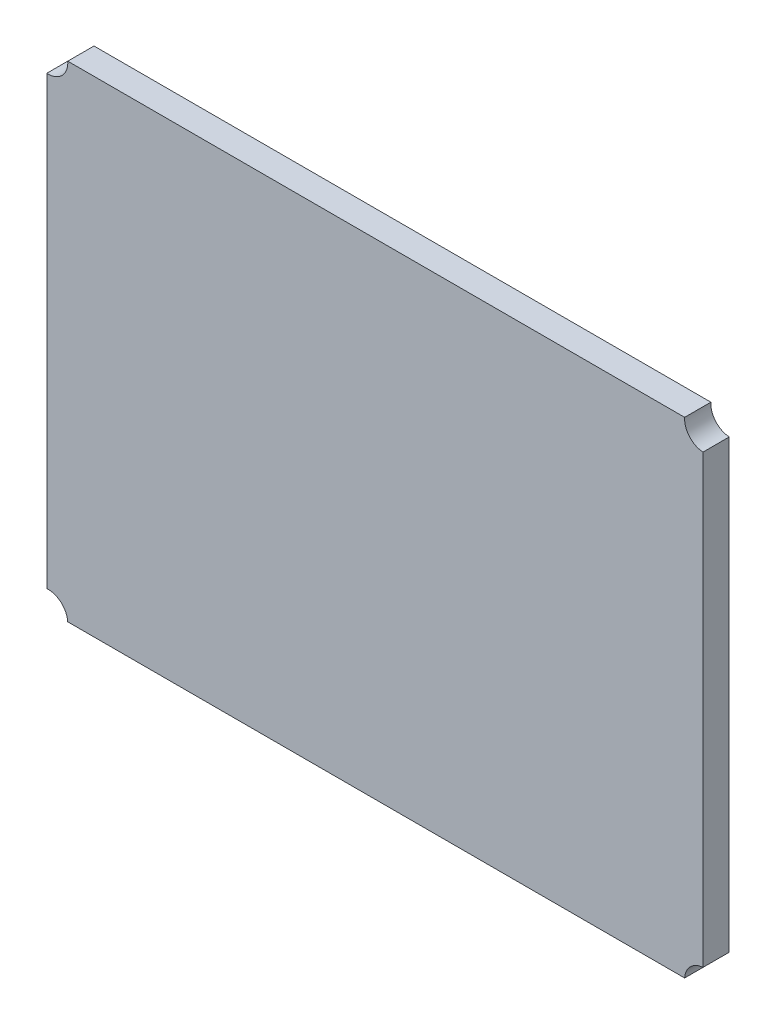
from build123d import *

# Parameters (mm, degrees)
BOSS_EXTRUDE1_DEPTH = 2


with BuildPart() as part:
    # Sketch1 → Boss-Extrude1 (new body)
    with BuildSketch(Plane.XY):
        with BuildLine():
            Line((23.603337045, 18.5), (-23.403337045, 18.5))
            ThreePointArc((-23.403337045, 18.5), (-23.400834493, 18.450027832), (-23.4, 18.4))
            ThreePointArc((-23.4, 18.4), (-23.875304923, 17.304554885), (-25, 16.903337045))
            Line((-25, 16.903337045), (-25, -17.103337045))
            ThreePointArc((-25, -17.103337045), (-23.912410154, -17.470988797), (-23.403337045, -18.5))
            Line((-23.403337045, -18.5), (23.603337045, -18.5))
            ThreePointArc((23.603337045, -18.5), (24.039339828, -17.539339828), (25, -17.103337045))
            Line((25, -17.103337045), (25, 16.903337045))
            ThreePointArc((25, 16.903337045), (23.970988797, 17.412410154), (23.603337045, 18.5))
        make_face()
    extrude(amount=BOSS_EXTRUDE1_DEPTH)


solid = part.part
